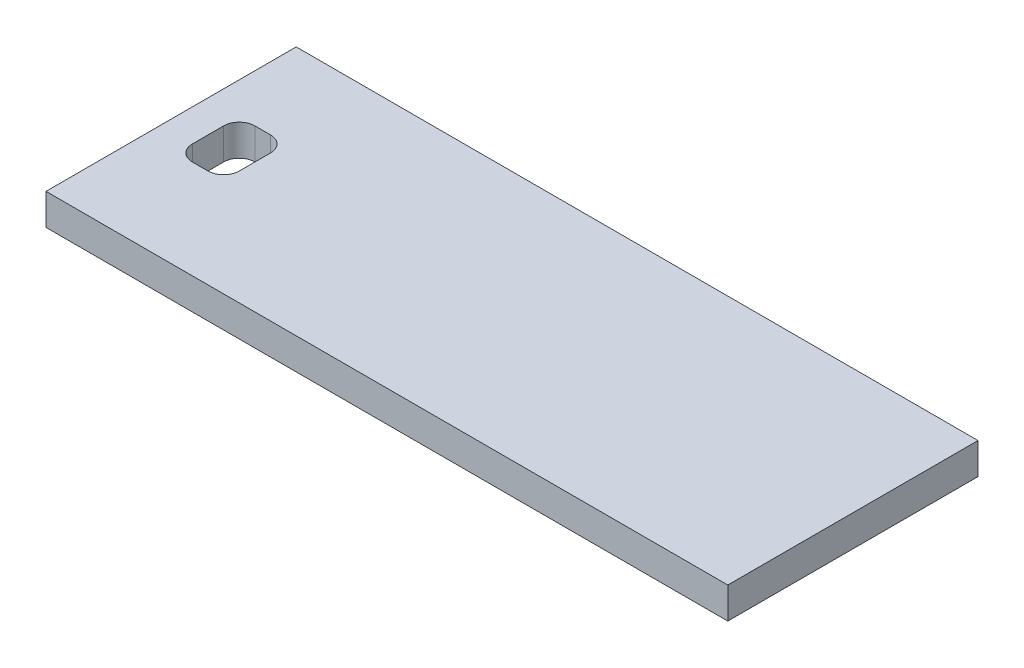
from build123d import *

# Parameters (mm, degrees)
SKETCH_1_W          = 218
SKETCH_1_H          = 80
EXTRUDE_1_DEPTH     = 10
SKETCH_2_W          = 15
SKETCH_2_H          = 20
CUT_EXTRUDE_1_DEPTH = 117.537547597
FILLET_1_R          = 5


with BuildPart() as part:
    # 草图1 → 凸台-拉伸1 (new body)
    with BuildSketch(Plane(origin=(0, 0, 0), x_dir=(1, 0, 0), z_dir=(0, 1, 0))):
        Rectangle(SKETCH_1_W, SKETCH_1_H)
    extrude(amount=EXTRUDE_1_DEPTH)

    # 草图2 → 切除-拉伸1 (cut, through all)
    with BuildSketch(Plane(origin=(0, 10, 0), x_dir=(1, 0, 0), z_dir=(0, 1, 0))):
        with Locations((-91.234833292, 1.528825843)):
            Rectangle(SKETCH_2_W, SKETCH_2_H)
    extrude(amount=-CUT_EXTRUDE_1_DEPTH, mode=Mode.SUBTRACT)

    # 圆角1
    fillet_1_edges = [part.edges().sort_by_distance(p)[0] for p in [
        (-98.734833292, 5, 8.471174157),
        (-98.734833292, 5, -11.528825843),
        (-83.734833292, 5, -11.528825843),
        (-83.734833292, 5, 8.471174157),
    ]]
    fillet(fillet_1_edges, radius=FILLET_1_R)


solid = part.part
